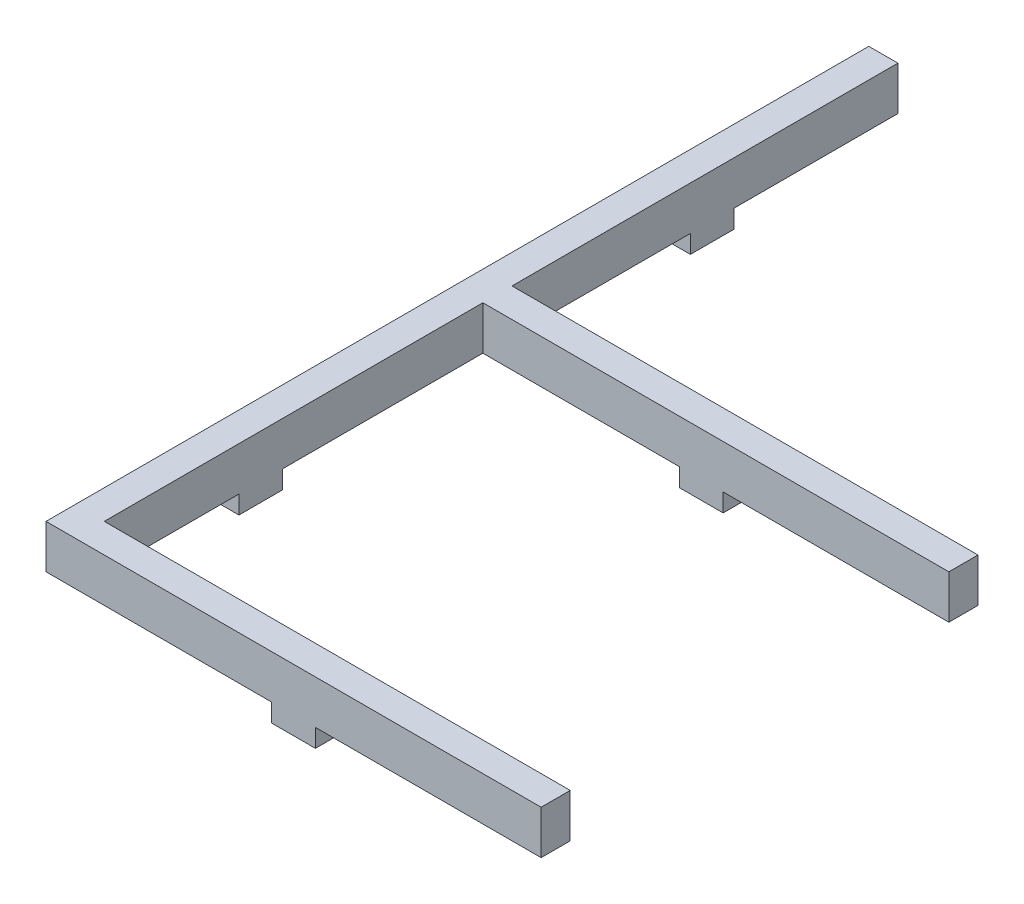
from build123d import *

# Parameters (mm, degrees)
RESSALTO_EXTRUS_O1_DEPTH = 3
ESBO_O3_W                = 3
ESBO_O3_H                = 1.25
RESSALTO_EXTRUS_O2_DEPTH = 2
ESBO_O4_W                = 3
ESBO_O4_H                = 1.25
RESSALTO_EXTRUS_O3_DEPTH = 2


with BuildPart() as part:
    # Esboço1 → Ressalto-extrusão1 (new body)
    with BuildSketch(Plane(origin=(0, 0, 0), x_dir=(1, 0, 0), z_dir=(0, 1, 0))):
        Polygon((0, -28), (0, -2), (32, -2), (32, 0), (0, 0), (0, 26.5), (-2, 26.5), (-2, -30), (32, -30), (32, -28), align=None)
    extrude(amount=RESSALTO_EXTRUS_O1_DEPTH)

    # Esboço3 → Ressalto-extrusão2 (add)
    with BuildSketch(Plane.ZY.offset(2)):
        with Locations((-13.75, -0.625)):
            Rectangle(ESBO_O3_W, ESBO_O3_H)
        with Locations((17.25, -0.625)):
            Rectangle(ESBO_O3_W, ESBO_O3_H)
    extrude(amount=-RESSALTO_EXTRUS_O2_DEPTH)

    # Esboço4 → Ressalto-extrusão3 (add)
    with BuildSketch(Plane.XY.offset(30)):
        with Locations((15, -0.625)):
            Rectangle(ESBO_O4_W, ESBO_O4_H)
    ressalto_extrus_o3 = extrude(amount=-RESSALTO_EXTRUS_O3_DEPTH)

    # Espelhar1: Ressalto-extrusão3 across plane
    add(ressalto_extrus_o3.mirror(Plane.XY.offset(15)))


solid = part.part
